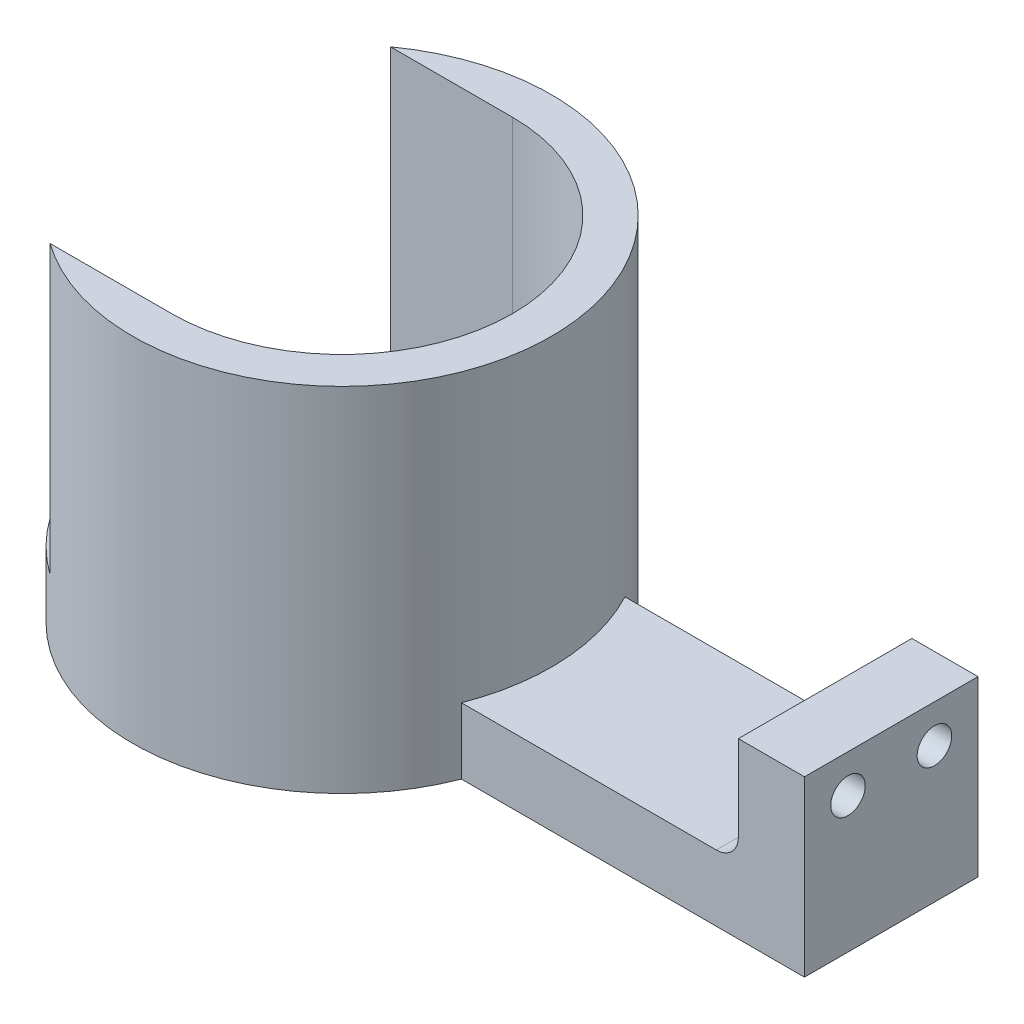
from build123d import *

# Parameters (mm, degrees)
SKETCH1_R           = 48.26
SKETCH1_R_2         = 26.56205
SKETCH1_W           = 81.370000074
SKETCH1_H           = 40
BOSS_EXTRUDE2_DEPTH = 15.24
SKETCH2_W           = 15.24
SKETCH2_H           = 24.76
BOSS_EXTRUDE3_DEPTH = 40
SKETCH3_R           = 3.9773733
SKETCH3_R_2         = 3.985133
CUT_EXTRUDE1_DEPTH  = 170.12215531
FILLET1_R           = 5.08
BOSS_EXTRUDE4_DEPTH = 66.04


with BuildPart() as part:
    # Sketch1 → Boss-Extrude2 (new body)
    # profile 1 of 2: a face of its own
    with BuildSketch(Plane(origin=(0, 0, 0), x_dir=(1, 0, 0), z_dir=(0, 1, 0))):
        Circle(SKETCH1_R)
        with Locations(Location((0, 0, 0), (0, 0, 90))):
            Circle(SKETCH1_R_2, mode=Mode.SUBTRACT)
    # profile 2 of 2: a face of its own
    with BuildSketch(Plane(origin=(0, 0, 0), x_dir=(1, 0, 0), z_dir=(0, 1, 0))):
        with Locations((83.372292456, 2.512722314)):
            Rectangle(SKETCH1_W, SKETCH1_H)
    extrude(amount=BOSS_EXTRUDE2_DEPTH)

    # Sketch2 → Boss-Extrude3 (add)
    with BuildSketch(Plane(origin=(0, 0, -22.512722314), x_dir=(-1, 0, 0), z_dir=(0, 0, -1))):
        with Locations((-116.437292493, 27.62)):
            Rectangle(SKETCH2_W, SKETCH2_H)
    extrude(amount=-BOSS_EXTRUDE3_DEPTH)

    # Sketch3 → Cut-Extrude1 (cut, through all)
    with BuildSketch(Plane.ZY.offset(-108.817292493)):
        with Locations((7.449197686, 31.22176)):
            Circle(SKETCH3_R)
        with Locations((-12.474642314, 31.22176)):
            Circle(SKETCH3_R_2)
    extrude(amount=-CUT_EXTRUDE1_DEPTH, mode=Mode.SUBTRACT)

    # Fillet1
    fillet1_edges = [part.edges().sort_by_distance(p)[0] for p in [
        (108.817292493, 15.24, -2.512722314),
    ]]
    fillet(fillet1_edges, radius=FILLET1_R)

    # Sketch5 → Boss-Extrude4 (add)
    with BuildSketch(Plane(origin=(0, 15.24, 0), x_dir=(1, 0, 0), z_dir=(0, 1, 0))):
        with BuildLine():
            ThreePointArc((0, 39.248127244), (39.248127244, 0), (0, -39.248127244))
            Line((0, -39.248127244), (-28.082238298, -39.248127244))
            ThreePointArc((-28.082238298, -39.248127244), (22.065570237, -42.920137583), (48.26, 0))
            ThreePointArc((48.26, 0), (22.065570237, 42.920137583), (-28.082238298, 39.248127244))
            Line((-28.082238298, 39.248127244), (0, 39.248127244))
        make_face()
    extrude(amount=BOSS_EXTRUDE4_DEPTH)


solid = part.part
